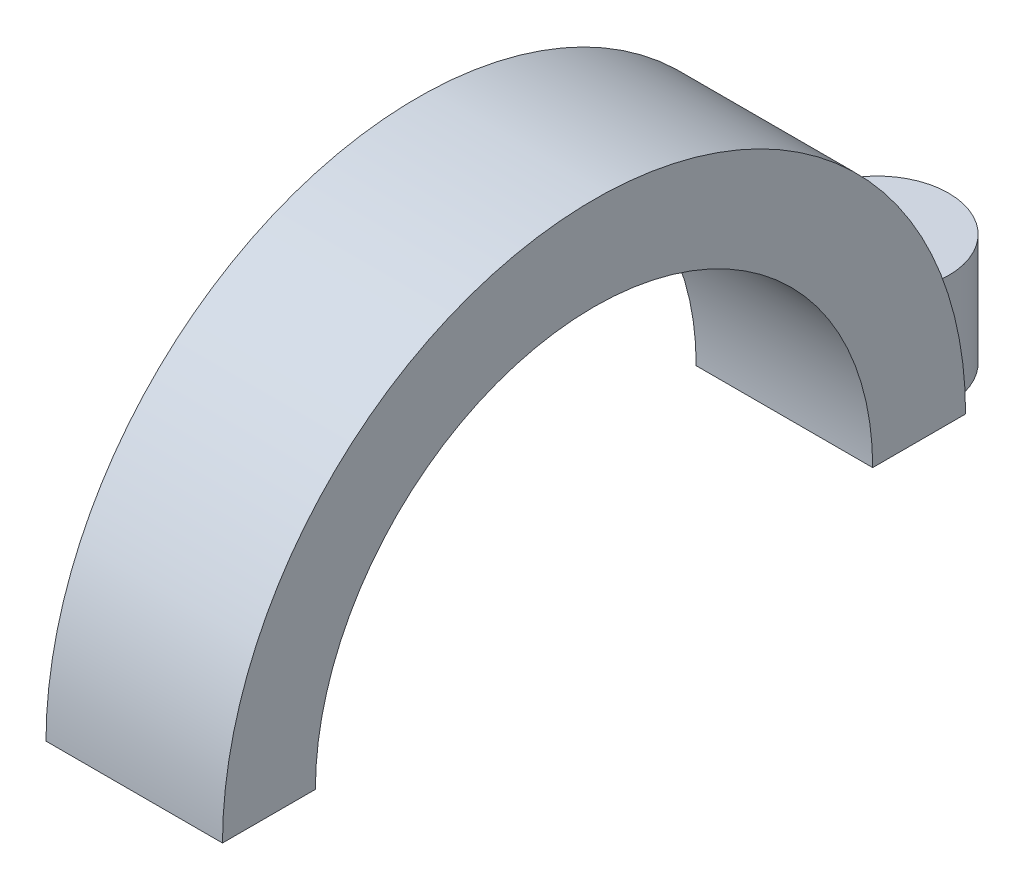
from build123d import *

# Parameters (mm, degrees)
BOSS_EXTRUDE1_DEPTH = 120.65
SKETCH2_R           = 97.5
BOSS_EXTRUDE2_DEPTH = 152.5


with BuildPart() as part:
    # Sketch1 → Boss-Extrude1 (new, symmetric)
    with BuildSketch(Plane(origin=(0, 0, 0), x_dir=(0, 0, -1), z_dir=(1, 0, 0))):
        with BuildLine():
            ThreePointArc((508, 0), (0, 508), (-508, 0))
            Line((-508, 0), (-381, 0))
            ThreePointArc((-381, 0), (0, 381), (381, 0))
            Line((381, 0), (508, 0))
        make_face()
    extrude(amount=BOSS_EXTRUDE1_DEPTH, both=True)

    # Sketch2 → Boss-Extrude2 (add)
    with BuildSketch(Plane.XZ):
        with Locations((0, -508)):
            Circle(SKETCH2_R)
    extrude(amount=-BOSS_EXTRUDE2_DEPTH)


solid = part.part
